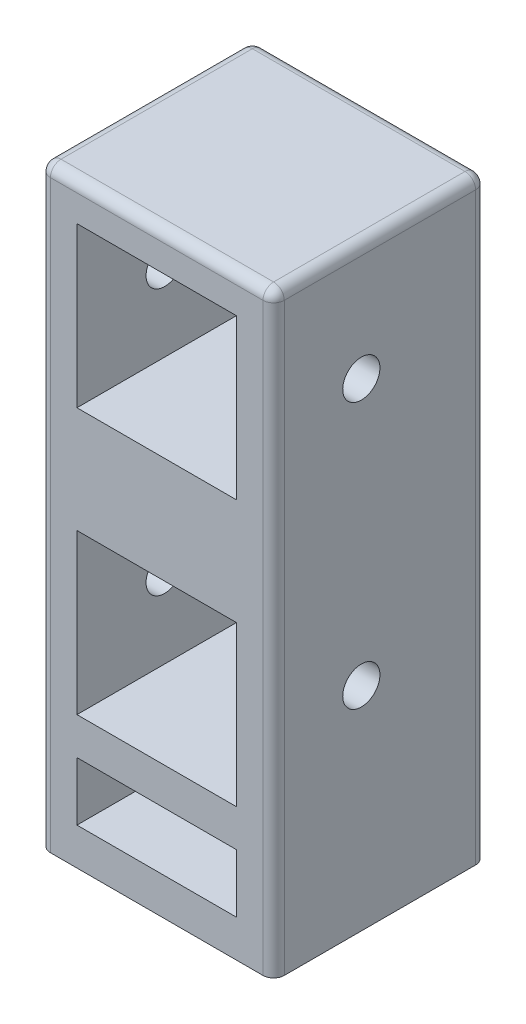
from build123d import *

# Parameters (mm, degrees)
SKETCH1_W           = 22
SKETCH1_H           = 56
SKETCH1_W_2         = 15
SKETCH1_H_2         = 15
BOSS_EXTRUDE1_DEPTH = 20
SKETCH2_W           = 15
SKETCH2_H           = 15
SKETCH2_H_2         = 5.5
CUT_EXTRUDE1_DEPTH  = 15.5
FILLET1_R           = 1
SKETCH3_R           = 1.75
CUT_EXTRUDE2_DEPTH  = 35


with BuildPart() as part:
    # Sketch1 → Boss-Extrude1 (new body)
    with BuildSketch(Plane.XY):
        with Locations((-14.096172604, 14.333947726)):
            Rectangle(SKETCH1_W, SKETCH1_H)
        with Locations((-14.096172604, 31.333947726)):
            Rectangle(SKETCH1_W_2, SKETCH1_H_2, mode=Mode.SUBTRACT)
    extrude(amount=BOSS_EXTRUDE1_DEPTH)

    # Sketch2 → Cut-Extrude1 (cut)
    with BuildSketch(Plane.XY.offset(20)):
        with Locations((-14.096172604, 6.333947726)):
            Rectangle(SKETCH2_W, SKETCH2_H)
        with Locations((-14.096172604, -7.416052274)):
            Rectangle(SKETCH2_W, SKETCH2_H_2)
    extrude(amount=-CUT_EXTRUDE1_DEPTH, mode=Mode.SUBTRACT)

    # Fillet1
    fillet1_edges = [part.edges().sort_by_distance(p)[0] for p in [
        (-3.096172604, 14.333947726, 20),
        (-14.096172604, 42.333947726, 20),
        (-25.096172604, 14.333947726, 20),
        (-14.096172604, 42.333947726, 0),
        (-3.096172604, 14.333947726, 0),
        (-25.096172604, 14.333947726, 0),
        (-25.096172604, 42.333947726, 10),
        (-3.096172604, 42.333947726, 10),
    ]]
    fillet(fillet1_edges, radius=FILLET1_R)

    # Sketch3 → Cut-Extrude2 (cut)
    with BuildSketch(Plane.ZY.offset(25.096172604)):
        with Locations(Location((11.75, 31.333947726, 0), (0, 0, 270))):
            Circle(SKETCH3_R)
        with Locations(Location((11.75, 6.333947726, 0), (0, 0, 90))):
            Circle(SKETCH3_R)
    extrude(amount=-CUT_EXTRUDE2_DEPTH, mode=Mode.SUBTRACT)


solid = part.part
